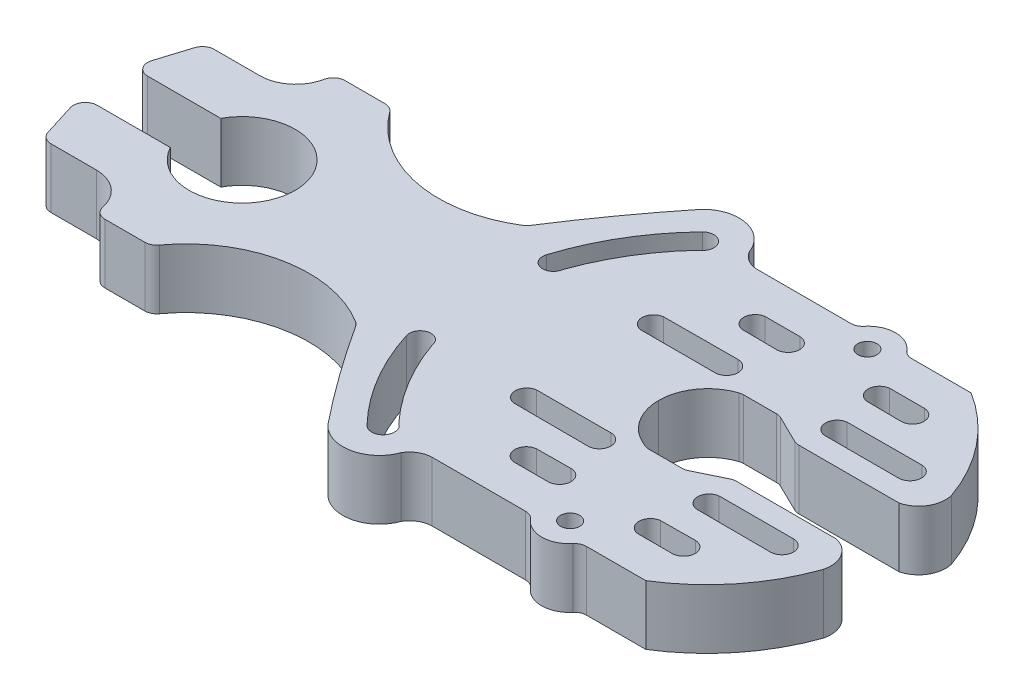
from build123d import *

# Parameters (mm, degrees)
SKETCH1_R           = 1.611042105
BOSS_EXTRUDE1_DEPTH = 10
FILLET1_R           = 2


with BuildPart() as part:
    # Sketch1 → Boss-Extrude1 (new body)
    with BuildSketch(Plane(origin=(0, 0, 0), x_dir=(1, 0, 0), z_dir=(0, 1, 0))):
        with BuildLine():
            Line((11.189092539, 48.886576386), (26.189092539, 48.886576386))
            ThreePointArc((26.189092539, 48.886576386), (42.916394787, 44.650618463), (26.189092539, 40.41466054))
            Line((26.189092539, 40.41466054), (11.189092539, 40.41466054))
            Line((11.189092539, 40.41466054), (14.151288092, 30.934521893))
            Line((14.151288092, 30.934521893), (23.265104761, 30.934521893))
            ThreePointArc((23.265104761, 30.934521893), (27.673263401, 29.01898123), (29.280956873, 24.489469079))
            Line((29.280956873, 24.489469079), (38.880945403, 24.489469079))
            ThreePointArc((38.880945403, 24.489469079), (51.981012749, 33.351282464), (67.510407542, 30.354384348))
            ThreePointArc((67.510407542, 30.354384348), (73.416192631, 21.647277215), (79.780316608, 13.269333663))
            ThreePointArc((79.780316608, 13.269333663), (85.455574773, 11.512983879), (89.942117167, 15.407114995))
            ThreePointArc((89.942117167, 15.407114995), (91.312456479, 16.8013043), (93.190330691, 17.344610927))
            Line((93.190330691, 17.344610927), (109.969813161, 17.344610927))
            ThreePointArc((109.969813161, 17.344610927), (114.023930948, 14.937059966), (118.078048735, 17.344610927))
            Line((118.078048735, 17.344610927), (129.094927047, 17.344610927))
            ThreePointArc((129.094927047, 17.344610927), (137.147462695, 24.481469598), (142.365392606, 33.89163907))
            ThreePointArc((142.365392606, 33.89163907), (141.864289866, 37.32830933), (139.079863875, 39.404069031))
            Line((139.079863875, 39.404069031), (121.785643939, 39.404069031))
            Line((121.785643939, 39.404069031), (116.256200304, 36.715011207))
            Line((116.256200304, 36.715011207), (109.969813161, 36.715011207))
            ThreePointArc((109.969813161, 36.715011207), (105.636801382, 39.677321657), (103.958530498, 44.650618463))
            ThreePointArc((103.958530498, 44.650618463), (105.636801382, 49.623915269), (109.969813161, 52.58622572))
            Line((109.969813161, 52.58622572), (116.256200304, 52.58622572))
            Line((116.256200304, 52.58622572), (121.785643939, 49.897167895))
            Line((121.785643939, 49.897167895), (139.079863875, 49.897167895))
            ThreePointArc((139.079863875, 49.897167895), (141.864289866, 51.972927596), (142.365392606, 55.409597857))
            ThreePointArc((142.365392606, 55.409597857), (137.147462695, 64.819767329), (129.094927047, 71.956626))
            Line((129.094927047, 71.956626), (118.078048735, 71.956626))
            ThreePointArc((118.078048735, 71.956626), (114.023930948, 74.364176961), (109.969813161, 71.956626))
            Line((109.969813161, 71.956626), (93.190330691, 71.956626))
            ThreePointArc((93.190330691, 71.956626), (91.312456479, 72.499932627), (89.942117167, 73.894121932))
            ThreePointArc((89.942117167, 73.894121932), (85.455574773, 77.788253047), (79.780316608, 76.031903263))
            ThreePointArc((79.780316608, 76.031903263), (73.416192631, 67.653959712), (67.510407542, 58.946852578))
            ThreePointArc((67.510407542, 58.946852578), (51.981012749, 55.949954462), (38.880945403, 64.811767847))
            Line((38.880945403, 64.811767847), (29.280956873, 64.811767847))
            ThreePointArc((29.280956873, 64.811767847), (27.673263401, 60.282255697), (23.265104761, 58.366715034))
            Line((23.265104761, 58.366715034), (14.151288092, 58.366715034))
            Line((14.151288092, 58.366715034), (11.189092539, 48.886576386))
        make_face()
        with Locations(Location((114.047069209, 69.608036313, 0), (0, 0, 270))):
            Circle(SKETCH1_R, mode=Mode.SUBTRACT)
        with Locations(Location((114.047069209, 19.693200614, 0), (0, 0, 270))):
            Circle(SKETCH1_R, mode=Mode.SUBTRACT)
        with BuildLine():
            Line((100.720147832, 65.775213403), (106.53630451, 65.775213403))
            ThreePointArc((106.53630451, 65.775213403), (108.429983462, 63.84444008), (106.53630451, 61.913666756))
            Line((106.53630451, 61.913666756), (100.720147832, 61.961340172))
            ThreePointArc((100.720147832, 61.961340172), (99.021225351, 63.868276787), (100.720147832, 65.775213403))
        make_face(mode=Mode.SUBTRACT)
        with BuildLine():
            Line((121.585405336, 65.7964452), (127.401562014, 65.7964452))
            ThreePointArc((127.401562014, 65.7964452), (129.295240966, 63.865671877), (127.401562014, 61.934898553))
            Line((127.401562014, 61.934898553), (121.585405336, 61.982571969))
            ThreePointArc((121.585405336, 61.982571969), (119.886482855, 63.889508585), (121.585405336, 65.7964452))
        make_face(mode=Mode.SUBTRACT)
        with BuildLine():
            Line((92.220268628, 53.391525043), (104.709229066, 53.391525043))
            ThreePointArc((104.709229066, 53.391525043), (106.602908018, 55.322298366), (104.709229066, 57.25307169))
            Line((104.709229066, 57.25307169), (92.220268628, 57.205398274))
            ThreePointArc((92.220268628, 57.205398274), (90.521346146, 55.298461659), (92.220268628, 53.391525043))
        make_face(mode=Mode.SUBTRACT)
        with BuildLine():
            Line((122.949689173, 53.478824533), (135.438649611, 53.478824533))
            ThreePointArc((135.438649611, 53.478824533), (137.332328563, 55.409597857), (135.438649611, 57.34037118))
            Line((135.438649611, 57.34037118), (122.949689173, 57.292697765))
            ThreePointArc((122.949689173, 57.292697765), (121.250766691, 55.385761149), (122.949689173, 53.478824533))
        make_face(mode=Mode.SUBTRACT)
        with BuildLine():
            Line((122.949689173, 32.008539162), (135.438649611, 31.960865746))
            ThreePointArc((135.438649611, 31.960865746), (137.332328563, 33.89163907), (135.438649611, 35.822412393))
            Line((135.438649611, 35.822412393), (122.949689173, 35.822412393))
            ThreePointArc((122.949689173, 35.822412393), (121.250766691, 33.915475777), (122.949689173, 32.008539162))
        make_face(mode=Mode.SUBTRACT)
        with BuildLine():
            Line((92.220268628, 32.095838652), (104.709229066, 32.048165237))
            ThreePointArc((104.709229066, 32.048165237), (106.602908018, 33.97893856), (104.709229066, 35.909711883))
            Line((104.709229066, 35.909711883), (92.220268628, 35.909711883))
            ThreePointArc((92.220268628, 35.909711883), (90.521346146, 34.002775268), (92.220268628, 32.095838652))
        make_face(mode=Mode.SUBTRACT)
        with BuildLine():
            Line((121.585405336, 27.318664957), (127.401562014, 27.366338373))
            ThreePointArc((127.401562014, 27.366338373), (129.295240966, 25.43556505), (127.401562014, 23.504791726))
            Line((127.401562014, 23.504791726), (121.585405336, 23.504791726))
            ThreePointArc((121.585405336, 23.504791726), (119.886482855, 25.411728342), (121.585405336, 27.318664957))
        make_face(mode=Mode.SUBTRACT)
        with BuildLine():
            Line((100.720147832, 27.339896755), (106.53630451, 27.38757017))
            ThreePointArc((106.53630451, 27.38757017), (108.429983462, 25.456796847), (106.53630451, 23.526023523))
            Line((106.53630451, 23.526023523), (100.720147832, 23.526023523))
            ThreePointArc((100.720147832, 23.526023523), (99.021225351, 25.432960139), (100.720147832, 27.339896755))
        make_face(mode=Mode.SUBTRACT)
        with BuildLine():
            ThreePointArc((73.357344755, 56.381475255), (77.294040814, 65.186077342), (83.163259717, 72.839237686))
            ThreePointArc((83.163259717, 72.839237686), (86.008327328, 72.620113362), (85.481100389, 69.815749453))
            ThreePointArc((85.481100389, 69.815749453), (80.447104068, 63.142353595), (76.888426245, 55.578548773))
            ThreePointArc((76.888426245, 55.578548773), (74.68795699, 54.067298901), (73.357344755, 56.381475255))
        make_face(mode=Mode.SUBTRACT)
        with BuildLine():
            ThreePointArc((85.481100389, 19.485487474), (80.447104068, 26.158883331), (76.888426245, 33.722688153))
            ThreePointArc((76.888426245, 33.722688153), (74.68795699, 35.233938025), (73.357344755, 32.919761671))
            ThreePointArc((73.357344755, 32.919761671), (77.294040814, 24.115159584), (83.163259717, 16.461999241))
            ThreePointArc((83.163259717, 16.461999241), (86.008327328, 16.681123564), (85.481100389, 19.485487474))
        make_face(mode=Mode.SUBTRACT)
    extrude(amount=BOSS_EXTRUDE1_DEPTH)

    # Fillet1
    fillet1_edges = [part.edges().sort_by_distance(p)[0] for p in [
        (67.510407542, 5, -30.354384348),
        (38.880945403, 5, -24.489469079),
        (29.280956873, 5, -24.489469079),
        (14.151288092, 5, -30.934521893),
        (11.189092539, 5, -40.41466054),
        (11.189092539, 5, -48.886576386),
        (14.151288092, 5, -58.366715034),
        (29.280956873, 5, -64.811767847),
        (38.880945403, 5, -64.811767847),
        (67.510407542, 5, -58.946852578),
        (109.969813161, 5, -71.956626),
        (118.078048735, 5, -71.956626),
        (121.785643939, 5, -49.897167895),
        (116.256200304, 5, -52.58622572),
        (109.969813161, 5, -52.58622572),
        (109.969813161, 5, -36.715011207),
        (116.256200304, 5, -36.715011207),
        (121.785643939, 5, -39.404069031),
        (118.078048735, 5, -17.344610927),
        (109.969813161, 5, -17.344610927),
    ]]
    fillet(fillet1_edges, radius=FILLET1_R)


solid = part.part
